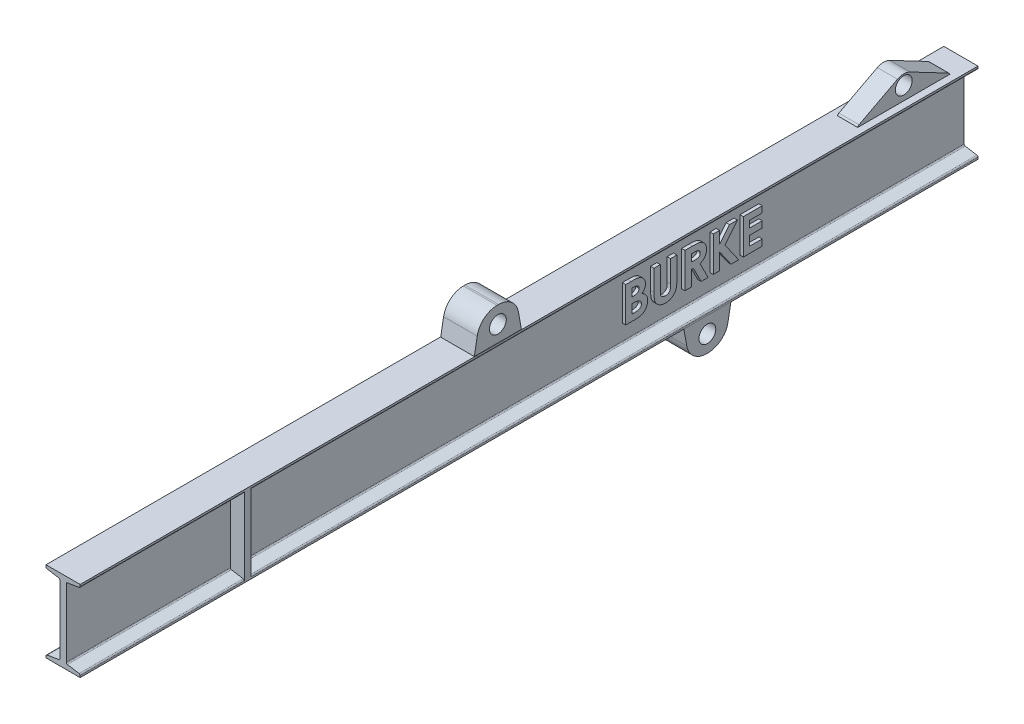
from build123d import *

# Parameters (mm, degrees)
BOSS_EXTRUDE1_DEPTH = 84.7725
SKETCH2_R           = 1.5875
BOSS_EXTRUDE2_DEPTH = 1.905
SKETCH3_R           = 1.5875
BOSS_EXTRUDE3_DEPTH = 3.175
BOSS_EXTRUDE5_REACH = 87.981
SKETCH6_W           = 1.27
SKETCH6_H           = 14.582933744
SKETCH6_2_W         = 1.27
SKETCH6_2_H         = 14.582933744
BOSS_EXTRUDE6_DEPTH = 3.82453
CIRPATTERN1_COUNT   = 2
BOSS_EXTRUDE7_DEPTH = 0.635
BOSS_EXTRUDE8_DEPTH = 0.635


with BuildPart() as part:
    # Sketch1 → Boss-Extrude1 (new, symmetric)
    with BuildSketch(Plane.XY):
        with BuildLine():
            Line((-3.012452092, -7.04095033), (-0.812077908, -6.672733973))
            ThreePointArc((-0.812077908, -6.672733973), (-0.660138953, -6.586332921), (-0.6, -6.42221743))
            Line((-0.6, -6.42221743), (-0.6, 6.42221743))
            ThreePointArc((-0.6, 6.42221743), (-0.660138953, 6.586332921), (-0.812077908, 6.672733973))
            Line((-0.812077908, 6.672733973), (-3.012452092, 7.04095033))
            ThreePointArc((-3.012452092, 7.04095033), (-3.164391047, 7.127351381), (-3.22453, 7.291466872))
            Line((-3.22453, 7.291466872), (-3.22453, 7.62))
            Line((-3.22453, 7.62), (-0.27178, 7.62))
            Line((-0.27178, 7.62), (0.27178, 7.62))
            Line((0.27178, 7.62), (3.22453, 7.62))
            Line((3.22453, 7.62), (3.22453, 7.291466872))
            ThreePointArc((3.22453, 7.291466872), (3.164391047, 7.127351381), (3.012452092, 7.04095033))
            Line((3.012452092, 7.04095033), (0.6, 6.637244302))
            Line((0.6, 6.637244302), (0.6, -6.42221743))
            ThreePointArc((0.6, -6.42221743), (0.660138953, -6.586332921), (0.812077908, -6.672733973))
            Line((0.812077908, -6.672733973), (3.012452092, -7.04095033))
            ThreePointArc((3.012452092, -7.04095033), (3.164391047, -7.127351381), (3.22453, -7.291466872))
            Line((3.22453, -7.291466872), (3.22453, -7.62))
            Line((3.22453, -7.62), (0.27178, -7.62))
            Line((0.27178, -7.62), (-0.27178, -7.62))
            Line((-0.27178, -7.62), (-3.22453, -7.62))
            Line((-3.22453, -7.62), (-3.22453, -7.291466872))
            ThreePointArc((-3.22453, -7.291466872), (-3.164391047, -7.127351381), (-3.012452092, -7.04095033))
        make_face()
    extrude(amount=BOSS_EXTRUDE1_DEPTH, both=True)

    # Sketch2 → Boss-Extrude2 (add, symmetric)
    with BuildSketch(Plane(origin=(0, 0, 0), x_dir=(0, 0, -1), z_dir=(1, 0, 0))):
        with BuildLine():
            Line((70.892213784, 11.752078934), (63.632183044, 7.942176379))
            ThreePointArc((63.632183044, 7.942176379), (63.433509865, 7.755171407), (63.360240287, 7.492353105))
            Line((63.360240287, 7.492353105), (63.360240287, 7.291466872))
            Line((63.360240287, 7.291466872), (80.784759713, 7.291466872))
            Line((80.784759713, 7.291466872), (80.784759713, 7.492353105))
            ThreePointArc((80.784759713, 7.492353105), (80.711490135, 7.755171407), (80.512816956, 7.942176379))
            Line((80.512816956, 7.942176379), (73.252786216, 11.752078934))
            ThreePointArc((73.252786216, 11.752078934), (72.0725, 12.042962564), (70.892213784, 11.752078934))
        make_face()
        with Locations(Location((72.0725, 10.16, 0), (0, 0, 180))):
            Circle(SKETCH2_R, mode=Mode.SUBTRACT)
    extrude(amount=BOSS_EXTRUDE2_DEPTH, both=True)

    # Sketch3 → Boss-Extrude3 (add, symmetric)
    with BuildSketch(Plane(origin=(0, 0, 0), x_dir=(0, 0, -1), z_dir=(1, 0, 0))):
        with BuildLine():
            Line((29.2735, -7.62), (38.1635, -7.62))
            Line((38.1635, -7.62), (37.621071229, -10.696266429))
            ThreePointArc((37.621071229, -10.696266429), (36.317974483, -12.953296201), (33.86895369, -13.844666872))
            Line((33.86895369, -13.844666872), (33.56804631, -13.844666872))
            ThreePointArc((33.56804631, -13.844666872), (31.119025517, -12.953296201), (29.815928771, -10.696266429))
            Line((29.815928771, -10.696266429), (29.2735, -7.62))
        make_face()
        with Locations((33.7185, -10.669666872)):
            Circle(SKETCH3_R, mode=Mode.SUBTRACT)
    boss_extrude3 = extrude(amount=BOSS_EXTRUDE3_DEPTH, both=True)

    # Boss-Extrude5: up to this face of the body (flat: up to its plane)
    boss_extrude5_end = Plane(part.part.faces().sort_by_distance((3.22453, 7.455733436, 0))[0])
    # Sketch6 → Boss-Extrude5 (add, up to the picked face)
    with BuildSketch(Plane(origin=(0.6, 0, 0), x_dir=(0, 0, -1), z_dir=(1, 0, 0)), mode=Mode.PRIVATE) as boss_extrude5_sk1:
        with Locations((-53.1495, 0)):
            Rectangle(SKETCH6_W, SKETCH6_H)
    boss_extrude5_tool1 = split(extrude(boss_extrude5_sk1.sketch, amount=BOSS_EXTRUDE5_REACH, mode=Mode.PRIVATE), bisect_by=boss_extrude5_end, keep=Keep.BOTH, mode=Mode.PRIVATE)
    add(boss_extrude5_tool1.solids().sort_by(Axis((0.6, 0, 53.1495), (1, 0, 0)))[0])

    # Sketch6<2> → Boss-Extrude6 (add)
    with BuildSketch(Plane(origin=(0.6, 0, 0), x_dir=(0, 0, -1), z_dir=(1, 0, 0))):
        with Locations((-53.1495, 0)):
            Rectangle(SKETCH6_2_W, SKETCH6_2_H)
    extrude(amount=-BOSS_EXTRUDE6_DEPTH)

    # CirPattern1: Boss-Extrude3 ×2 about axis
    cirpattern1_axis = Axis((0, 0, -13.93825), (1, 0, 0))
    for i in range(1, CIRPATTERN1_COUNT):
        add(boss_extrude3.rotate(cirpattern1_axis, i * 360 / CIRPATTERN1_COUNT))

    # Sketch7 → Boss-Extrude7 (add)
    # profile 1 of 5: a face of its own
    with BuildSketch(Plane(origin=(0.6, 0, 0), x_dir=(0, 0, -1), z_dir=(1, 0, 0))):
        with BuildLine():
            Line((20.23305535, -3.446792832), (20.23305535, 3.167790501))
            Line((20.23305535, 3.167790501), (21.293084731, 3.167790501))
            add(Edge.make_bspline(
                [(21.293084731, 3.167790501), (21.367293415, 3.16779897), (21.510885813, 3.167815358), (21.718052169, 3.160540356), (21.910181469, 3.151129325), (22.086662282, 3.14060057), (22.247794991, 3.122457423), (22.393334568, 3.103336527), (22.523571801, 3.080277905), (22.604090406, 3.059593606), (22.641972117, 3.049862233)],
                knots=[0, 0, 0, 0, 1.311965854, 2.538629056, 3.664479157, 4.713267157, 5.663616078, 6.530575999, 7.308677837, 8, 8, 8, 8], degree=3))
            add(Edge.make_bspline(
                [(22.641972117, 3.049862233), (22.69171465, 3.036135957), (22.789325469, 3.009200597), (22.929135311, 2.954803475), (23.061764448, 2.894337216), (23.187050944, 2.825356524), (23.304225491, 2.747028608), (23.412842784, 2.658731835), (23.51524543, 2.564010433), (23.607797345, 2.460224543), (23.691449028, 2.350555525), (23.764127342, 2.235032115), (23.827275481, 2.115420742), (23.877810533, 1.990216176), (23.915887746, 1.859995018), (23.94373726, 1.725313332), (23.961787516, 1.585744953), (23.963493029, 1.490792022), (23.964358769, 1.442592685)],
                knots=[0, 0, 0, 0, 1.099996261, 2.158545794, 3.195537121, 4.207578794, 5.205712374, 6.197378256, 7.190519799, 8.17788031, 9.159561366, 10.129234751, 11.085776129, 12.040971148, 13.00380137, 13.975669004, 14.972423361, 16, 16, 16, 16], degree=3))
            add(Edge.make_bspline(
                [(23.964358769, 1.442592685), (23.962095115, 1.380669188), (23.957639392, 1.258780392), (23.929175925, 1.079747803), (23.875802489, 0.910536274), (23.805964646, 0.748027299), (23.711007015, 0.592827039), (23.590429188, 0.445009287), (23.446184132, 0.300022512), (23.33554021, 0.213112721), (23.277989745, 0.167907355)],
                knots=[0, 0, 0, 0, 0.986156485, 1.941127874, 2.875419072, 3.804401753, 4.751181392, 5.761612777, 6.835722519, 8, 8, 8, 8], degree=3))
            add(Edge.make_bspline(
                [(23.277989745, 0.167907355), (23.324625881, 0.144100012), (23.416066441, 0.097420399), (23.545885173, 0.02069305), (23.666083148, -0.060916217), (23.777199297, -0.14576539), (23.876902832, -0.237451349), (23.969310679, -0.330691023), (24.049863915, -0.430826658), (24.121897046, -0.534289228), (24.184507073, -0.642576885), (24.239033503, -0.755506753), (24.285090022, -0.873464628), (24.324091873, -0.995850197), (24.353179465, -1.123084411), (24.372145193, -1.255212774), (24.38666654, -1.39178466), (24.387796164, -1.484814019), (24.388370521, -1.532114764)],
                knots=[0, 0, 0, 0, 1.164658916, 2.283573913, 3.35186032, 4.395461096, 5.390182219, 6.362969632, 7.312859996, 8.245001507, 9.165155236, 10.092416118, 11.032087915, 11.979892451, 12.947605196, 13.931445124, 14.948243989, 16, 16, 16, 16], degree=3))
            add(Edge.make_bspline(
                [(24.388370521, -1.532114764), (24.384643327, -1.622456483), (24.377287726, -1.800745502), (24.323507155, -2.06251473), (24.230268735, -2.3106957), (24.105068762, -2.544302036), (23.950798307, -2.756571217), (23.773431524, -2.942517176), (23.574754089, -3.099916303), (23.391450141, -3.206148503), (23.232906662, -3.277440243), (23.101588061, -3.321517292), (22.960554666, -3.362350204), (22.807223086, -3.391023918), (22.644373012, -3.417269254), (22.470416645, -3.433473668), (22.285679108, -3.444455001), (22.158793382, -3.4459978), (22.093406913, -3.446792832)],
                knots=[0, 0, 0, 0, 1.284142165, 2.534249414, 3.780121997, 5.041676246, 6.291546858, 7.49970053, 8.684500223, 9.883330709, 10.50184324, 11.153274765, 11.851151195, 12.587658647, 13.369265475, 14.195992086, 15.070362669, 16, 16, 16, 16], degree=3))
            Line((22.093406913, -3.446792832), (20.23305535, -3.446792832))
        make_face()
        with BuildLine():
            Line((21.420288256, 1.980557595), (21.420288256, 0.538917638))
            Line((21.420288256, 0.538917638), (21.735646997, 0.538917638))
            add(Edge.make_bspline(
                [(21.735646997, 0.538917638), (21.778507083, 0.539291394), (21.861245886, 0.540012908), (21.98075331, 0.549305753), (22.091875914, 0.565159925), (22.194192235, 0.587280483), (22.288655387, 0.615370366), (22.37466191, 0.649168544), (22.451833651, 0.690405996), (22.541489365, 0.751831), (22.636261921, 0.842220643), (22.719689135, 0.972807211), (22.768827207, 1.122981266), (22.774299863, 1.228895639), (22.777125863, 1.283588278)],
                knots=[0, 0, 0, 0, 1.065314748, 2.056525647, 2.977365736, 3.853934255, 4.656397591, 5.425096493, 6.14721249, 6.826394842, 8.123232004, 9.372140726, 10.643011755, 12, 12, 12, 12], degree=3))
            add(Edge.make_bspline(
                [(22.777125863, 1.283588278), (22.774864546, 1.334817021), (22.77049238, 1.433865738), (22.721016659, 1.572938957), (22.644171083, 1.696186293), (22.55344408, 1.780539015), (22.468006977, 1.838149437), (22.394850486, 1.876083447), (22.314555744, 1.910041585), (22.225568331, 1.936006804), (22.128396413, 1.955490191), (22.023512009, 1.969798405), (21.910734157, 1.979537185), (21.832838255, 1.980210163), (21.792623576, 1.980557595)],
                knots=[0, 0, 0, 0, 1.347982417, 2.606269829, 3.849316587, 5.153353503, 5.842674298, 6.568177932, 7.326619318, 8.142485038, 9.012069166, 9.942760135, 10.937925643, 12, 12, 12, 12], degree=3))
            Line((21.792623576, 1.980557595), (21.420288256, 1.980557595))
        make_face(mode=Mode.SUBTRACT)
        with BuildLine():
            Line((21.420288256, -0.563512917), (21.420288256, -2.259559926))
            Line((21.420288256, -2.259559926), (21.762147731, -2.259559926))
            add(Edge.make_bspline(
                [(21.762147731, -2.259559926), (21.829733785, -2.259173809), (21.959676406, -2.258431452), (22.145818982, -2.24946201), (22.315069118, -2.23329617), (22.466978367, -2.213114422), (22.601779406, -2.185771309), (22.719016575, -2.151008046), (22.82029763, -2.112762402), (22.905015285, -2.06552449), (22.974224756, -2.010551275), (23.036679048, -1.954367328), (23.087600385, -1.889553838), (23.127890298, -1.818893067), (23.162761146, -1.744140281), (23.183792779, -1.662376409), (23.199805526, -1.576024737), (23.200686751, -1.516297153), (23.201137615, -1.485738478)],
                knots=[0, 0, 0, 0, 1.753078804, 3.370512758, 4.83203934, 6.162291463, 7.344201807, 8.395507345, 9.331626367, 10.147333109, 10.898971645, 11.62040215, 12.321813352, 13.025280112, 13.727906689, 14.453419512, 15.208716525, 16, 16, 16, 16], degree=3))
            add(Edge.make_bspline(
                [(23.201137615, -1.485738478), (23.20014333, -1.450794153), (23.198206729, -1.382732008), (23.182390485, -1.283251919), (23.153647204, -1.190380656), (23.117443638, -1.101743374), (23.067064454, -1.020513598), (23.007190515, -0.943880272), (22.934847511, -0.874438438), (22.853493584, -0.807987995), (22.758602282, -0.749807031), (22.650129085, -0.69932474), (22.527484708, -0.657163789), (22.390289247, -0.623595213), (22.239144156, -0.595106026), (22.072946242, -0.578094836), (21.89307966, -0.565442867), (21.768357244, -0.564170852), (21.703846115, -0.563512917)],
                knots=[0, 0, 0, 0, 0.845221588, 1.646264278, 2.427170338, 3.19324141, 3.95557735, 4.731569926, 5.540061037, 6.376114724, 7.268642756, 8.224665384, 9.265483498, 10.400594375, 11.639216012, 12.983232105, 14.439614077, 16, 16, 16, 16], degree=3))
            Line((21.703846115, -0.563512917), (21.420288256, -0.563512917))
        make_face(mode=Mode.SUBTRACT)
    # profile 2 of 5: a face of its own
    with BuildSketch(Plane(origin=(0.6, 0, 0), x_dir=(0, 0, -1), z_dir=(1, 0, 0))):
        with BuildLine():
            Line((25.575603427, 3.167790501), (26.762836333, 3.167790501))
            Line((26.762836333, 3.167790501), (26.762836333, -1.135928783))
            add(Edge.make_bspline(
                [(26.762836333, -1.135928783), (26.762900889, -1.180547878), (26.763025578, -1.266729199), (26.769267574, -1.390371178), (26.774979431, -1.504024044), (26.785285242, -1.607563373), (26.800510457, -1.701033454), (26.815253434, -1.785034707), (26.835206595, -1.858063182), (26.865193005, -1.941188707), (26.91139222, -2.034584774), (26.986879174, -2.131924298), (27.073984662, -2.220760742), (27.178385605, -2.294704832), (27.295723033, -2.354518936), (27.425352228, -2.398834568), (27.567090459, -2.423468175), (27.66509467, -2.427228946), (27.715537739, -2.429164627)],
                knots=[0, 0, 0, 0, 1.155499968, 2.231836252, 3.205919964, 4.102923608, 4.924856345, 5.658536265, 6.31071849, 6.882491295, 7.94666036, 8.992281882, 10.060072772, 11.158554251, 12.289267114, 13.461410017, 14.693379945, 16, 16, 16, 16], degree=3))
            add(Edge.make_bspline(
                [(27.715537739, -2.429164627), (27.769127274, -2.427600845), (27.873617795, -2.424551737), (28.023910775, -2.394621431), (28.163158073, -2.346962134), (28.288411349, -2.278940172), (28.399545956, -2.197403929), (28.493619073, -2.104427061), (28.56786123, -1.999824125), (28.616249507, -1.903319951), (28.643417141, -1.814496263), (28.663780636, -1.735135668), (28.678709331, -1.641498022), (28.692253133, -1.535045678), (28.700391915, -1.414675995), (28.709217098, -1.281357001), (28.712451609, -1.134176493), (28.713002908, -1.031691943), (28.713290393, -0.978249413)],
                knots=[0, 0, 0, 0, 1.261321664, 2.459363699, 3.594844139, 4.716940403, 5.803436589, 6.833651888, 7.818396249, 8.814403945, 9.360733334, 10.004355033, 10.743453831, 11.592799886, 12.532235708, 13.585170094, 14.740740724, 16, 16, 16, 16], degree=3))
            Line((28.713290393, -0.978249413), (28.713290393, 3.167790501))
            Line((28.713290393, 3.167790501), (29.900523299, 3.167790501))
            Line((29.900523299, 3.167790501), (29.900523299, -0.778168867))
            add(Edge.make_bspline(
                [(29.900523299, -0.778168867), (29.90035843, -0.858113815), (29.900041403, -1.011840154), (29.895172828, -1.232755721), (29.884808512, -1.434526654), (29.876103682, -1.617211912), (29.859256856, -1.780565387), (29.841706414, -1.925284644), (29.819336867, -2.050856831), (29.786052325, -2.193805507), (29.72861306, -2.358405671), (29.636013434, -2.547935625), (29.518464203, -2.73349693), (29.379526886, -2.913048285), (29.222653946, -3.079845707), (29.051323592, -3.226272253), (28.868257838, -3.350133322), (28.671543777, -3.44840036), (28.461348823, -3.525041242), (28.235593254, -3.576540054), (27.994431018, -3.611333298), (27.827855703, -3.614675618), (27.742038473, -3.616397533)],
                knots=[0, 0, 0, 0, 1.170808336, 2.251350247, 3.235597562, 4.129743112, 4.929140599, 5.639994148, 6.264258765, 6.79612947, 7.788252245, 8.809469599, 9.879094798, 10.999557536, 12.129761673, 13.226370002, 14.293821979, 15.358369427, 16.438775801, 17.562147481, 18.744053101, 20, 20, 20, 20], degree=3))
            add(Edge.make_bspline(
                [(27.742038473, -3.616397533), (27.685019798, -3.615437129), (27.572523123, -3.613542271), (27.407077026, -3.596834573), (27.247140873, -3.57221371), (27.093015184, -3.536294405), (26.944165016, -3.489893373), (26.800629916, -3.432776933), (26.662943295, -3.365263675), (26.531875628, -3.287974574), (26.407588205, -3.204399716), (26.293995916, -3.111753467), (26.187189783, -3.016887369), (26.090255392, -2.915809052), (26.002464679, -2.809579667), (25.923998448, -2.697958462), (25.854973274, -2.580955353), (25.793652868, -2.456461366), (25.741168585, -2.31814892), (25.696922363, -2.161098185), (25.658267823, -1.982847547), (25.629542049, -1.782995417), (25.603499093, -1.562200486), (25.587015338, -1.319887548), (25.578391944, -1.056049653), (25.57655642, -0.873136309), (25.575603427, -0.778168867)],
                knots=[0, 0, 0, 0, 1.001158378, 1.975264943, 2.917723546, 3.841610987, 4.75185031, 5.653588123, 6.552117133, 7.442167995, 8.324307438, 9.179605724, 10.014504199, 10.831958861, 11.636465792, 12.43274043, 13.225645099, 14.020104002, 14.867201867, 15.819789774, 16.883317127, 18.068162734, 19.364263498, 20.787406516, 22.332041935, 24, 24, 24, 24], degree=3))
            Line((25.575603427, -0.778168867), (25.575603427, 3.167790501))
        make_face()
    # profile 3 of 5: a face of its own
    with BuildSketch(Plane(origin=(0.6, 0, 0), x_dir=(0, 0, -1), z_dir=(1, 0, 0))):
        with BuildLine():
            Line((31.426965607, 3.167790501), (32.810303948, 3.167790501))
            add(Edge.make_bspline(
                [(32.810303948, 3.167790501), (32.901742191, 3.167465948), (33.07760369, 3.166841741), (33.331186365, 3.156993401), (33.564136926, 3.143288629), (33.776800277, 3.122374783), (33.969085436, 3.094645551), (34.141185119, 3.061957375), (34.293094294, 3.02470219), (34.426094107, 2.97827929), (34.546119862, 2.925914963), (34.658000552, 2.865747391), (34.764204432, 2.798446559), (34.864021643, 2.7222416), (34.958319621, 2.638503423), (35.047276265, 2.547147736), (35.129634534, 2.447399882), (35.204884463, 2.339890139), (35.273468716, 2.226792355), (35.334082811, 2.107951246), (35.383374294, 1.983284165), (35.426928603, 1.854592822), (35.458299361, 1.720037549), (35.480117264, 1.580928263), (35.496091479, 1.436775285), (35.49700992, 1.338844153), (35.497478427, 1.288888425)],
                knots=[0, 0, 0, 0, 1.749336639, 3.364467119, 4.854658419, 6.213483162, 7.451590619, 8.570285859, 9.5643256, 10.440900261, 11.26203566, 12.067320669, 12.869050712, 13.665104639, 14.467235401, 15.27997916, 16.102287765, 16.939272006, 17.78853747, 18.631303466, 19.488103222, 20.351255419, 21.228522269, 22.127379805, 23.044756219, 24, 24, 24, 24], degree=3))
            add(Edge.make_bspline(
                [(35.497478427, 1.288888425), (35.496261415, 1.23674612), (35.493875077, 1.134504565), (35.48102096, 0.98432006), (35.457527672, 0.84063403), (35.421943669, 0.70386717), (35.38104448, 0.572317258), (35.32665905, 0.448411472), (35.265279717, 0.330347782), (35.192381276, 0.219796242), (35.112378799, 0.114301284), (35.019337601, 0.017904809), (34.919285322, -0.074574127), (34.80659766, -0.157342958), (34.686241991, -0.235998213), (34.555826976, -0.307280821), (34.416203746, -0.372982662), (34.318041701, -0.409622548), (34.267844346, -0.428359171)],
                knots=[0, 0, 0, 0, 1.099860209, 2.156625411, 3.176576793, 4.16617041, 5.135385252, 6.078461593, 7.016046972, 7.938469504, 8.868247731, 9.803980173, 10.76021508, 11.73834243, 12.748633912, 13.790971185, 14.870363756, 16, 16, 16, 16], degree=3))
            Line((34.267844346, -0.428359171), (35.794286654, -3.446792832))
            Line((35.794286654, -3.446792832), (34.474550075, -3.446792832))
            Line((34.474550075, -3.446792832), (33.017009677, -0.563512917))
            Line((33.017009677, -0.563512917), (32.614198513, -0.563512917))
            Line((32.614198513, -0.563512917), (32.614198513, -3.446792832))
            Line((32.614198513, -3.446792832), (31.426965607, -3.446792832))
            Line((31.426965607, -3.446792832), (31.426965607, 3.167790501))
        make_face()
        with BuildLine():
            Line((32.614198513, 0.623719989), (33.07663633, 0.623719989))
            add(Edge.make_bspline(
                [(33.07663633, 0.623719989), (33.133173197, 0.624356745), (33.241429149, 0.625575996), (33.397115427, 0.631231389), (33.538515697, 0.644858091), (33.666237179, 0.66207492), (33.780922555, 0.681954236), (33.881548874, 0.710442502), (33.969666632, 0.7409684), (34.044231632, 0.778904174), (34.107938254, 0.822045376), (34.162944845, 0.871054854), (34.208443183, 0.927777084), (34.245890635, 0.990670601), (34.275020682, 1.060291682), (34.296283385, 1.135876047), (34.308166091, 1.218284696), (34.309533237, 1.275157886), (34.310245521, 1.304788865)],
                knots=[0, 0, 0, 0, 1.688639943, 3.233382647, 4.650958383, 5.928841754, 7.082724185, 8.122798841, 9.049171256, 9.863274652, 10.613301712, 11.341792392, 12.054588806, 12.776240173, 13.521029143, 14.301969904, 15.115324896, 16, 16, 16, 16], degree=3))
            add(Edge.make_bspline(
                [(34.310245521, 1.304788865), (34.308898883, 1.339844477), (34.306253661, 1.40870473), (34.280004845, 1.50783935), (34.238222399, 1.599595223), (34.18095011, 1.683557773), (34.108823108, 1.757165141), (34.026051682, 1.822050622), (33.930849426, 1.873357205), (33.842699301, 1.907198481), (33.762503291, 1.927446066), (33.690128923, 1.942534387), (33.606318968, 1.953227913), (33.511010156, 1.964570301), (33.404445431, 1.971925266), (33.286043952, 1.977292924), (33.156145767, 1.979489096), (33.065594395, 1.980191174), (33.018334714, 1.980557595)],
                knots=[0, 0, 0, 0, 1.020303359, 2.004196876, 2.966617323, 3.9489082, 4.950758222, 5.960522915, 7.003732012, 8.091992268, 8.70421221, 9.413913587, 10.24622431, 11.166358409, 12.212345909, 13.359657661, 14.621978493, 16, 16, 16, 16], degree=3))
            Line((33.018334714, 1.980557595), (32.614198513, 1.980557595))
            Line((32.614198513, 1.980557595), (32.614198513, 0.623719989))
        make_face(mode=Mode.SUBTRACT)
    # profile 4 of 5: a face of its own
    with BuildSketch(Plane(origin=(0.6, 0, 0), x_dir=(0, 0, -1), z_dir=(1, 0, 0))):
        Polygon((36.769513684, 3.167790501), (37.95674659, 3.167790501), (37.95674659, 0.839700975), (39.832998593, 3.167790501), (41.331615129, 3.167790501), (38.974374795, 0.242109412), (41.560846483, -3.446792832), (40.131131856, -3.446792832), (37.95674659, -0.344881858), (37.95674659, -3.446792832), (36.769513684, -3.446792832), align=None)
    # profile 5 of 5: a face of its own
    with BuildSketch(Plane(origin=(0.6, 0, 0), x_dir=(0, 0, -1), z_dir=(1, 0, 0))):
        Polygon((42.451271162, 3.167790501), (46.01296988, 3.167790501), (46.01296988, 1.980557595), (43.638504068, 1.980557595), (43.638504068, 0.708522339), (46.01296988, 0.708522339), (46.01296988, -0.478710567), (43.638504068, -0.478710567), (43.638504068, -2.259559926), (46.01296988, -2.259559926), (46.01296988, -3.446792832), (42.451271162, -3.446792832), align=None)
    extrude(amount=BOSS_EXTRUDE7_DEPTH)

    # Sketch8 → Boss-Extrude8 (add)
    # profile 1 of 5: a face of its own
    with BuildSketch(Plane.ZY.offset(0.6)):
        with BuildLine():
            Line((-46.119457891, -3.273702318), (-46.119457891, 3.340881015))
            Line((-46.119457891, 3.340881015), (-45.059428511, 3.340881015))
            add(Edge.make_bspline(
                [(-45.059428511, 3.340881015), (-44.985219826, 3.340889484), (-44.841627428, 3.340905872), (-44.634461072, 3.333630869), (-44.442331773, 3.324219839), (-44.265850959, 3.313691084), (-44.10471825, 3.295547937), (-43.959178673, 3.276427041), (-43.82894144, 3.253368419), (-43.748422836, 3.23268412), (-43.710541124, 3.222952747)],
                knots=[0, 0, 0, 0, 1.311965854, 2.538629056, 3.664479157, 4.713267157, 5.663616078, 6.530575999, 7.308677837, 8, 8, 8, 8], degree=3))
            add(Edge.make_bspline(
                [(-43.710541124, 3.222952747), (-43.660798591, 3.209226471), (-43.563187773, 3.182291111), (-43.423377931, 3.127893989), (-43.290748793, 3.06742773), (-43.165462297, 2.998447038), (-43.048287751, 2.920119122), (-42.939670457, 2.831822349), (-42.837267811, 2.737100946), (-42.744715896, 2.633315057), (-42.661064214, 2.523646039), (-42.5883859, 2.408122629), (-42.52523776, 2.288511256), (-42.474702708, 2.16330669), (-42.436625496, 2.033085532), (-42.408775982, 1.898403846), (-42.390725725, 1.758835466), (-42.389020213, 1.663882536), (-42.388154472, 1.615683199)],
                knots=[0, 0, 0, 0, 1.099996261, 2.158545794, 3.195537121, 4.207578794, 5.205712374, 6.197378256, 7.190519799, 8.17788031, 9.159561366, 10.129234751, 11.085776129, 12.040971148, 13.00380137, 13.975669004, 14.972423361, 16, 16, 16, 16], degree=3))
            add(Edge.make_bspline(
                [(-42.388154472, 1.615683199), (-42.390418126, 1.553759702), (-42.39487385, 1.431870906), (-42.423337317, 1.252838317), (-42.476710753, 1.083626788), (-42.546548595, 0.921117813), (-42.641506226, 0.765917553), (-42.762084053, 0.618099801), (-42.90632911, 0.473113026), (-43.016973031, 0.386203235), (-43.074523496, 0.340997869)],
                knots=[0, 0, 0, 0, 0.986156485, 1.941127874, 2.875419072, 3.804401753, 4.751181392, 5.761612777, 6.835722519, 8, 8, 8, 8], degree=3))
            add(Edge.make_bspline(
                [(-43.074523496, 0.340997869), (-43.02788736, 0.317190526), (-42.9364468, 0.270510913), (-42.806628068, 0.193783564), (-42.686430094, 0.112174297), (-42.575313945, 0.027325124), (-42.47561041, -0.064360835), (-42.383202562, -0.157600509), (-42.302649327, -0.257736144), (-42.230616195, -0.361198714), (-42.168006168, -0.469486371), (-42.113479739, -0.582416239), (-42.06742322, -0.700374114), (-42.028421368, -0.822759683), (-41.999333777, -0.949993897), (-41.980368049, -1.08212226), (-41.965846702, -1.218694146), (-41.964717077, -1.311723505), (-41.96414272, -1.35902425)],
                knots=[0, 0, 0, 0, 1.164658916, 2.283573913, 3.35186032, 4.395461096, 5.390182219, 6.362969632, 7.312859996, 8.245001507, 9.165155236, 10.092416118, 11.032087915, 11.979892451, 12.947605196, 13.931445124, 14.948243989, 16, 16, 16, 16], degree=3))
            add(Edge.make_bspline(
                [(-41.96414272, -1.35902425), (-41.967869914, -1.449365969), (-41.975225516, -1.627654988), (-42.029006086, -1.889424216), (-42.122244507, -2.137605186), (-42.247444479, -2.371211522), (-42.401714934, -2.583480703), (-42.579081718, -2.769426662), (-42.777759153, -2.926825789), (-42.9610631, -3.033057989), (-43.119606579, -3.104349729), (-43.250925181, -3.148426778), (-43.391958575, -3.18925969), (-43.545290156, -3.217933404), (-43.70814023, -3.24417874), (-43.882096596, -3.260383155), (-44.066834133, -3.271364487), (-44.19371986, -3.272907286), (-44.259106329, -3.273702318)],
                knots=[0, 0, 0, 0, 1.284142165, 2.534249414, 3.780121997, 5.041676246, 6.291546858, 7.49970053, 8.684500223, 9.883330709, 10.50184324, 11.153274765, 11.851151195, 12.587658647, 13.369265475, 14.195992086, 15.070362669, 16, 16, 16, 16], degree=3))
            Line((-44.259106329, -3.273702318), (-46.119457891, -3.273702318))
        make_face()
        with BuildLine():
            Line((-44.932224985, 2.153648109), (-44.932224985, 0.712008152))
            Line((-44.932224985, 0.712008152), (-44.616866245, 0.712008152))
            add(Edge.make_bspline(
                [(-44.616866245, 0.712008152), (-44.574006158, 0.712381908), (-44.491267356, 0.713103422), (-44.371759932, 0.722396267), (-44.260637327, 0.738250439), (-44.158321006, 0.760370996), (-44.063857855, 0.788460879), (-43.977851331, 0.822259058), (-43.90067959, 0.86349651), (-43.811023876, 0.924921513), (-43.716251321, 1.015311157), (-43.632824106, 1.145897724), (-43.583686034, 1.29607178), (-43.578213378, 1.401986153), (-43.575387378, 1.456678792)],
                knots=[0, 0, 0, 0, 1.065314748, 2.056525647, 2.977365736, 3.853934255, 4.656397591, 5.425096493, 6.14721249, 6.826394842, 8.123232004, 9.372140726, 10.643011755, 12, 12, 12, 12], degree=3))
            add(Edge.make_bspline(
                [(-43.575387378, 1.456678792), (-43.577648696, 1.507907535), (-43.582020862, 1.606956252), (-43.631496582, 1.746029471), (-43.708342158, 1.869276807), (-43.799069162, 1.953629529), (-43.884506265, 2.011239951), (-43.957662756, 2.049173961), (-44.037957497, 2.083132098), (-44.126944911, 2.109097318), (-44.224116828, 2.128580705), (-44.329001232, 2.142888919), (-44.441779084, 2.152627699), (-44.519674987, 2.153300676), (-44.559889665, 2.153648109)],
                knots=[0, 0, 0, 0, 1.347982417, 2.606269829, 3.849316587, 5.153353503, 5.842674298, 6.568177932, 7.326619318, 8.142485038, 9.012069166, 9.942760135, 10.937925643, 12, 12, 12, 12], degree=3))
            Line((-44.559889665, 2.153648109), (-44.932224985, 2.153648109))
        make_face(mode=Mode.SUBTRACT)
        with BuildLine():
            Line((-44.932224985, -0.390422404), (-44.932224985, -2.086469412))
            Line((-44.932224985, -2.086469412), (-44.59036551, -2.086469412))
            add(Edge.make_bspline(
                [(-44.59036551, -2.086469412), (-44.522779457, -2.086083296), (-44.392836835, -2.085340938), (-44.20669426, -2.076371496), (-44.037444123, -2.060205656), (-43.885534875, -2.040023908), (-43.750733836, -2.012680796), (-43.633496667, -1.977917532), (-43.532215611, -1.939671888), (-43.447497956, -1.892433976), (-43.378288485, -1.837460761), (-43.315834194, -1.781276814), (-43.264912856, -1.716463324), (-43.224622944, -1.645802553), (-43.189752096, -1.571049767), (-43.168720462, -1.489285895), (-43.152707715, -1.402934223), (-43.151826491, -1.343206639), (-43.151375626, -1.312647964)],
                knots=[0, 0, 0, 0, 1.753078804, 3.370512758, 4.83203934, 6.162291463, 7.344201807, 8.395507345, 9.331626367, 10.147333109, 10.898971645, 11.62040215, 12.321813352, 13.025280112, 13.727906689, 14.453419512, 15.208716525, 16, 16, 16, 16], degree=3))
            add(Edge.make_bspline(
                [(-43.151375626, -1.312647964), (-43.152369912, -1.277703639), (-43.154306513, -1.209641494), (-43.170122757, -1.110161405), (-43.198866038, -1.017290142), (-43.235069603, -0.92865286), (-43.285448788, -0.847423084), (-43.345322727, -0.770789758), (-43.41766573, -0.701347925), (-43.499019658, -0.634897481), (-43.59391096, -0.576716517), (-43.702384156, -0.526234226), (-43.825028533, -0.484073275), (-43.962223994, -0.450504699), (-44.113369085, -0.422015512), (-44.279566999, -0.405004322), (-44.459433582, -0.392352353), (-44.584155997, -0.391080338), (-44.648667126, -0.390422404)],
                knots=[0, 0, 0, 0, 0.845221588, 1.646264278, 2.427170338, 3.19324141, 3.95557735, 4.731569926, 5.540061037, 6.376114724, 7.268642756, 8.224665384, 9.265483498, 10.400594375, 11.639216012, 12.983232105, 14.439614077, 16, 16, 16, 16], degree=3))
            Line((-44.648667126, -0.390422404), (-44.932224985, -0.390422404))
        make_face(mode=Mode.SUBTRACT)
    # profile 2 of 5: a face of its own
    with BuildSketch(Plane.ZY.offset(0.6)):
        with BuildLine():
            Line((-40.776909814, 3.340881015), (-39.589676908, 3.340881015))
            Line((-39.589676908, 3.340881015), (-39.589676908, -0.962838269))
            add(Edge.make_bspline(
                [(-39.589676908, -0.962838269), (-39.589612352, -1.007457364), (-39.589487663, -1.093638685), (-39.583245667, -1.217280664), (-39.57753381, -1.330933531), (-39.567227999, -1.434472859), (-39.552002784, -1.527942941), (-39.537259808, -1.611944193), (-39.517306647, -1.684972668), (-39.487320236, -1.768098193), (-39.441121021, -1.86149426), (-39.365634067, -1.958833784), (-39.27852858, -2.047670228), (-39.174127636, -2.121614318), (-39.056790209, -2.181428422), (-38.927161014, -2.225744054), (-38.785422783, -2.250377661), (-38.687418571, -2.254138432), (-38.636975503, -2.256074113)],
                knots=[0, 0, 0, 0, 1.155499968, 2.231836252, 3.205919964, 4.102923608, 4.924856345, 5.658536265, 6.31071849, 6.882491295, 7.94666036, 8.992281882, 10.060072772, 11.158554251, 12.289267114, 13.461410017, 14.693379945, 16, 16, 16, 16], degree=3))
            add(Edge.make_bspline(
                [(-38.636975503, -2.256074113), (-38.583385967, -2.254510332), (-38.478895446, -2.251461223), (-38.328602467, -2.221530917), (-38.189355169, -2.173871621), (-38.064101892, -2.105849658), (-37.952967285, -2.024313415), (-37.858894169, -1.931336547), (-37.784652011, -1.826733611), (-37.736263735, -1.730229437), (-37.709096101, -1.641405749), (-37.688732605, -1.562045154), (-37.673803911, -1.468407508), (-37.660260108, -1.361955164), (-37.652121326, -1.241585481), (-37.643296144, -1.108266487), (-37.640061633, -0.961085979), (-37.639510334, -0.858601429), (-37.639222848, -0.805158899)],
                knots=[0, 0, 0, 0, 1.261321664, 2.459363699, 3.594844139, 4.716940403, 5.803436589, 6.833651888, 7.818396249, 8.814403945, 9.360733334, 10.004355033, 10.743453831, 11.592799886, 12.532235708, 13.585170094, 14.740740724, 16, 16, 16, 16], degree=3))
            Line((-37.639222848, -0.805158899), (-37.639222848, 3.340881015))
            Line((-37.639222848, 3.340881015), (-36.451989943, 3.340881015))
            Line((-36.451989943, 3.340881015), (-36.451989943, -0.605078353))
            add(Edge.make_bspline(
                [(-36.451989943, -0.605078353), (-36.452154811, -0.685023301), (-36.452471838, -0.83874964), (-36.457340413, -1.059665207), (-36.467704729, -1.26143614), (-36.476409559, -1.444121398), (-36.493256386, -1.607474873), (-36.510806827, -1.75219413), (-36.533176375, -1.877766317), (-36.566460916, -2.020714993), (-36.623900181, -2.185315157), (-36.716499807, -2.374845111), (-36.834049039, -2.560406417), (-36.972986356, -2.739957771), (-37.129859295, -2.906755193), (-37.301189649, -3.053181739), (-37.484255404, -3.177042808), (-37.680969465, -3.275309846), (-37.891164418, -3.351950728), (-38.116919987, -3.40344954), (-38.358082223, -3.438242784), (-38.524657538, -3.441585104), (-38.610474768, -3.443307019)],
                knots=[0, 0, 0, 0, 1.170808336, 2.251350247, 3.235597562, 4.129743112, 4.929140599, 5.639994148, 6.264258765, 6.79612947, 7.788252245, 8.809469599, 9.879094798, 10.999557536, 12.129761673, 13.226370002, 14.293821979, 15.358369427, 16.438775801, 17.562147481, 18.744053101, 20, 20, 20, 20], degree=3))
            add(Edge.make_bspline(
                [(-38.610474768, -3.443307019), (-38.667493443, -3.442346615), (-38.779990119, -3.440451757), (-38.945436216, -3.423744059), (-39.105372368, -3.399123196), (-39.259498058, -3.363203891), (-39.408348225, -3.316802859), (-39.551883325, -3.259686419), (-39.689569946, -3.192173161), (-39.820637613, -3.11488406), (-39.944925036, -3.031309202), (-40.058517326, -2.938662954), (-40.165323458, -2.843796855), (-40.262257849, -2.742718538), (-40.350048563, -2.636489153), (-40.428514794, -2.524867948), (-40.497539967, -2.407864839), (-40.558860373, -2.283370852), (-40.611344656, -2.145058406), (-40.655590878, -1.988007671), (-40.694245419, -1.809757033), (-40.722971193, -1.609904903), (-40.749014148, -1.389109972), (-40.765497903, -1.146797034), (-40.774121297, -0.882959139), (-40.775956822, -0.700045795), (-40.776909814, -0.605078353)],
                knots=[0, 0, 0, 0, 1.001158378, 1.975264943, 2.917723546, 3.841610987, 4.75185031, 5.653588123, 6.552117133, 7.442167995, 8.324307438, 9.179605724, 10.014504199, 10.831958861, 11.636465792, 12.43274043, 13.225645099, 14.020104002, 14.867201867, 15.819789774, 16.883317127, 18.068162734, 19.364263498, 20.787406516, 22.332041935, 24, 24, 24, 24], degree=3))
            Line((-40.776909814, -0.605078353), (-40.776909814, 3.340881015))
        make_face()
    # profile 3 of 5: a face of its own
    with BuildSketch(Plane.ZY.offset(0.6)):
        with BuildLine():
            Line((-34.925547635, 3.340881015), (-33.542209293, 3.340881015))
            add(Edge.make_bspline(
                [(-33.542209293, 3.340881015), (-33.45077105, 3.340556462), (-33.274909552, 3.339932255), (-33.021326876, 3.330083915), (-32.788376315, 3.316379143), (-32.575712965, 3.295465297), (-32.383427805, 3.267736065), (-32.211328123, 3.235047889), (-32.059418947, 3.197792704), (-31.926419134, 3.151369804), (-31.80639338, 3.099005477), (-31.69451269, 3.038837905), (-31.58830881, 2.971537073), (-31.488491598, 2.895332114), (-31.39419362, 2.811593937), (-31.305236977, 2.72023825), (-31.222878708, 2.620490395), (-31.147628779, 2.512980653), (-31.079044525, 2.399882869), (-31.01843043, 2.28104176), (-30.969138947, 2.156374679), (-30.925584638, 2.027683336), (-30.89421388, 1.893128062), (-30.872395977, 1.754018777), (-30.856421762, 1.609865799), (-30.855503321, 1.511934667), (-30.855034814, 1.461978939)],
                knots=[0, 0, 0, 0, 1.749336639, 3.364467119, 4.854658419, 6.213483162, 7.451590619, 8.570285859, 9.5643256, 10.440900261, 11.26203566, 12.067320669, 12.869050712, 13.665104639, 14.467235401, 15.27997916, 16.102287765, 16.939272006, 17.78853747, 18.631303466, 19.488103222, 20.351255419, 21.228522269, 22.127379805, 23.044756219, 24, 24, 24, 24], degree=3))
            add(Edge.make_bspline(
                [(-30.855034814, 1.461978939), (-30.856251826, 1.409836634), (-30.858638165, 1.307595079), (-30.871492282, 1.157410574), (-30.89498557, 1.013724544), (-30.930569572, 0.876957684), (-30.971468761, 0.745407772), (-31.025854191, 0.621501986), (-31.087233525, 0.503438296), (-31.160131965, 0.392886756), (-31.240134443, 0.287391798), (-31.333175641, 0.190995323), (-31.433227919, 0.098516387), (-31.545915582, 0.015747556), (-31.66627125, -0.062907699), (-31.796686266, -0.134190307), (-31.936309495, -0.199892149), (-32.03447154, -0.236532034), (-32.084668895, -0.255268658)],
                knots=[0, 0, 0, 0, 1.099860209, 2.156625411, 3.176576793, 4.16617041, 5.135385252, 6.078461593, 7.016046972, 7.938469504, 8.868247731, 9.803980173, 10.76021508, 11.73834243, 12.748633912, 13.790971185, 14.870363756, 16, 16, 16, 16], degree=3))
            Line((-32.084668895, -0.255268658), (-30.558226588, -3.273702318))
            Line((-30.558226588, -3.273702318), (-31.877963166, -3.273702318))
            Line((-31.877963166, -3.273702318), (-33.335503564, -0.390422404))
            Line((-33.335503564, -0.390422404), (-33.738314729, -0.390422404))
            Line((-33.738314729, -0.390422404), (-33.738314729, -3.273702318))
            Line((-33.738314729, -3.273702318), (-34.925547635, -3.273702318))
            Line((-34.925547635, -3.273702318), (-34.925547635, 3.340881015))
        make_face()
        with BuildLine():
            Line((-33.738314729, 0.796810502), (-33.275876912, 0.796810502))
            add(Edge.make_bspline(
                [(-33.275876912, 0.796810502), (-33.219340044, 0.797447259), (-33.111084092, 0.79866651), (-32.955397814, 0.804321903), (-32.813997545, 0.817948605), (-32.686276063, 0.835165434), (-32.571590686, 0.85504475), (-32.470964368, 0.883533016), (-32.382846609, 0.914058914), (-32.308281609, 0.951994688), (-32.244574987, 0.99513589), (-32.189568396, 1.044145368), (-32.144070059, 1.100867598), (-32.106622606, 1.163761115), (-32.077492559, 1.233382196), (-32.056229857, 1.30896656), (-32.04434715, 1.39137521), (-32.042980004, 1.4482484), (-32.04226772, 1.477879379)],
                knots=[0, 0, 0, 0, 1.688639943, 3.233382647, 4.650958383, 5.928841754, 7.082724185, 8.122798841, 9.049171256, 9.863274652, 10.613301712, 11.341792392, 12.054588806, 12.776240173, 13.521029143, 14.301969904, 15.115324896, 16, 16, 16, 16], degree=3))
            add(Edge.make_bspline(
                [(-32.04226772, 1.477879379), (-32.043614359, 1.512934991), (-32.04625958, 1.581795244), (-32.072508397, 1.680929864), (-32.114290842, 1.772685736), (-32.171563131, 1.856648287), (-32.243690134, 1.930255655), (-32.326461559, 1.995141136), (-32.421663815, 2.046447719), (-32.509813941, 2.080288995), (-32.59000995, 2.10053658), (-32.662384319, 2.115624901), (-32.746194273, 2.126318427), (-32.841503086, 2.137660815), (-32.948067811, 2.145015779), (-33.066469289, 2.150383437), (-33.196367474, 2.15257961), (-33.286918846, 2.153281688), (-33.334178528, 2.153648109)],
                knots=[0, 0, 0, 0, 1.020303359, 2.004196876, 2.966617323, 3.9489082, 4.950758222, 5.960522915, 7.003732012, 8.091992268, 8.70421221, 9.413913587, 10.24622431, 11.166358409, 12.212345909, 13.359657661, 14.621978493, 16, 16, 16, 16], degree=3))
            Line((-33.334178528, 2.153648109), (-33.738314729, 2.153648109))
            Line((-33.738314729, 2.153648109), (-33.738314729, 0.796810502))
        make_face(mode=Mode.SUBTRACT)
    # profile 4 of 5: a face of its own
    with BuildSketch(Plane.ZY.offset(0.6)):
        Polygon((-29.582999558, 3.340881015), (-28.395766652, 3.340881015), (-28.395766652, 1.012791489), (-26.519514649, 3.340881015), (-25.020898112, 3.340881015), (-27.378138447, 0.415199925), (-24.791666759, -3.273702318), (-26.221381385, -3.273702318), (-28.395766652, -0.171791344), (-28.395766652, -3.273702318), (-29.582999558, -3.273702318), align=None)
    # profile 5 of 5: a face of its own
    with BuildSketch(Plane.ZY.offset(0.6)):
        Polygon((-23.901242079, 3.340881015), (-20.339543361, 3.340881015), (-20.339543361, 2.153648109), (-22.714009173, 2.153648109), (-22.714009173, 0.881612853), (-20.339543361, 0.881612853), (-20.339543361, -0.305620053), (-22.714009173, -0.305620053), (-22.714009173, -2.086469412), (-20.339543361, -2.086469412), (-20.339543361, -3.273702318), (-23.901242079, -3.273702318), align=None)
    extrude(amount=BOSS_EXTRUDE8_DEPTH)


solid = part.part
